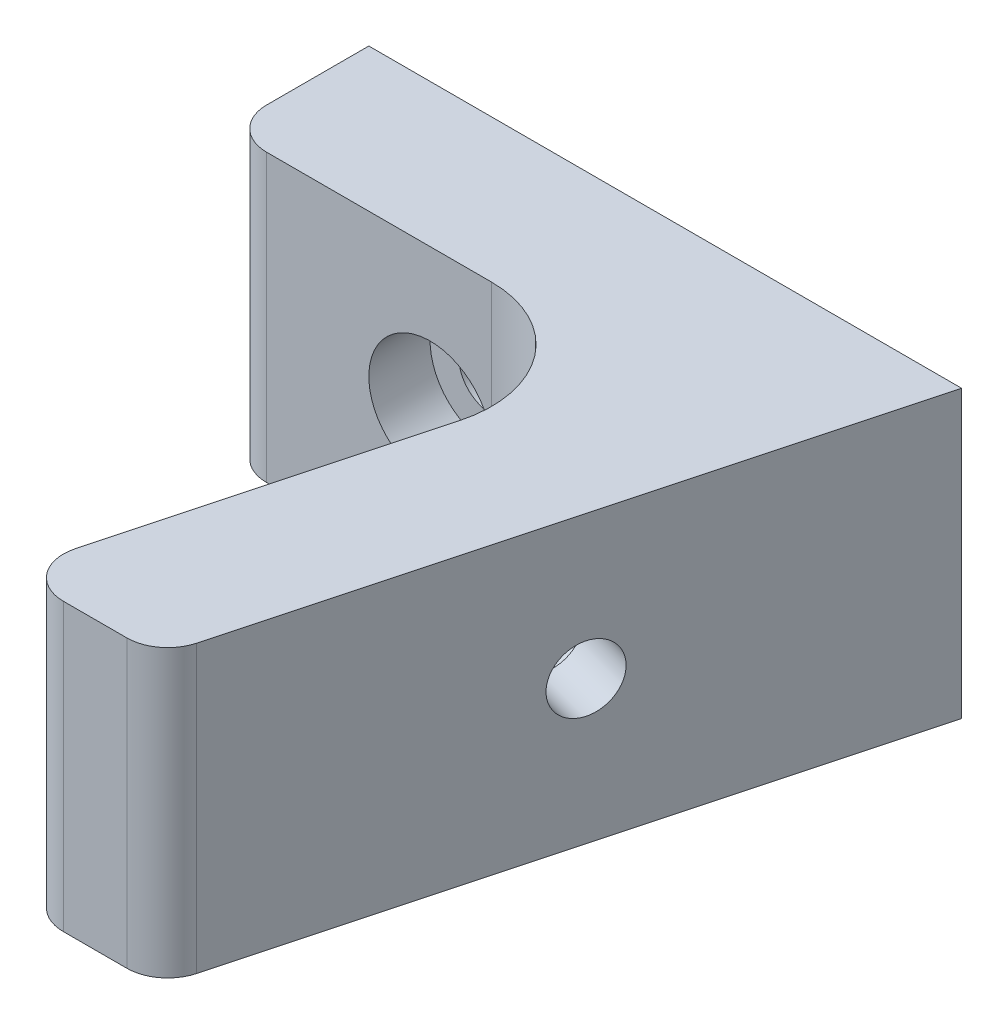
from build123d import *

# Parameters (mm, degrees)
BOSS_EXTRU_1_DEPTH                              = 7
CHAMBRAGE_POUR_VIS_T_TE_CYLINDRIQUE_D           = 3.2
CHAMBRAGE_POUR_VIS_T_TE_CYLINDRIQUE_CBORE_D     = 6
CHAMBRAGE_POUR_VIS_T_TE_CYLINDRIQUE_CBORE_DEPTH = 3
CONG_1_R                                        = 2
ESQUISSE5_R                                     = 1.6
ENL_V_MAT_EXTRU_1_DEPTH                         = 10
ENL_V_START                                     = -3
ENL_V_MAT_EXTRU_2_DEPTH                         = 7


with BuildPart() as part:
    # Esquisse1 → Boss.-Extru.1 (new, symmetric)
    with BuildSketch(Plane(origin=(0, 0, 0), x_dir=(1, 0, 0), z_dir=(0, 1, 0))):
        with BuildLine():
            Line((-10, 0), (-10, -7))
            Line((-10, -7), (3, -7))
            ThreePointArc((3, -7), (7.186709482, -9.064656631), (8.097414494, -13.643079905))
            Line((8.097414494, -13.643079905), (3.446641772, -31))
            Line((3.446641772, -31), (10.693575035, -31))
            Line((10.693575035, -31), (19, 0))
            Line((19, 0), (-10, 0))
        make_face()
    extrude(amount=BOSS_EXTRU_1_DEPTH, both=True)

    # Chambrage pour vis à tête cylindrique à 6 pans creux (ou vis CHC) M31 (through all)
    with Locations(Plane.XY.offset(7)):
        with Locations((0, 0)):
            CounterBoreHole(CHAMBRAGE_POUR_VIS_T_TE_CYLINDRIQUE_D / 2, CHAMBRAGE_POUR_VIS_T_TE_CYLINDRIQUE_CBORE_D / 2, CHAMBRAGE_POUR_VIS_T_TE_CYLINDRIQUE_CBORE_DEPTH)

    # Congé1
    cong_1_edges = [part.edges().sort_by_distance(p)[0] for p in [
        (10.693575035, 0, 31),
        (3.446641772, 0, 31),
        (-10, 0, 7),
    ]]
    fillet(cong_1_edges, radius=CONG_1_R)

    # Esquisse5 → Enlèv. mat.-Extru.1 (cut)
    with BuildSketch(Plane(origin=(17.727241336, 0, 4.75), x_dir=(0.25881904510252474, 0, -0.9659258262890673), z_dir=(0.9659258262890673, 0, 0.25881904510252474))):
        with Locations((-10.082438143, 0)):
            Circle(ESQUISSE5_R)
    extrude(amount=-ENL_V_MAT_EXTRU_1_DEPTH, mode=Mode.SUBTRACT)

    # Esquisse6 → Enlèv. mat.-Extru.2 (cut)
    with BuildSketch(Plane(origin=(17.727241336, 0, 4.75), x_dir=(0.25881904510252474, 0, -0.9659258262890673), z_dir=(0.9659258262890673, 0, 0.25881904510252474)).offset(ENL_V_START)):
        Polygon((-7.332438143, 1.58771324), (-10.082438143, 3.175426481), (-12.832438143, 1.58771324), (-12.832438143, -1.58771324), (-10.082438143, -3.175426481), (-7.332438143, -1.58771324), align=None)
    extrude(amount=-ENL_V_MAT_EXTRU_2_DEPTH, mode=Mode.SUBTRACT)


solid = part.part
